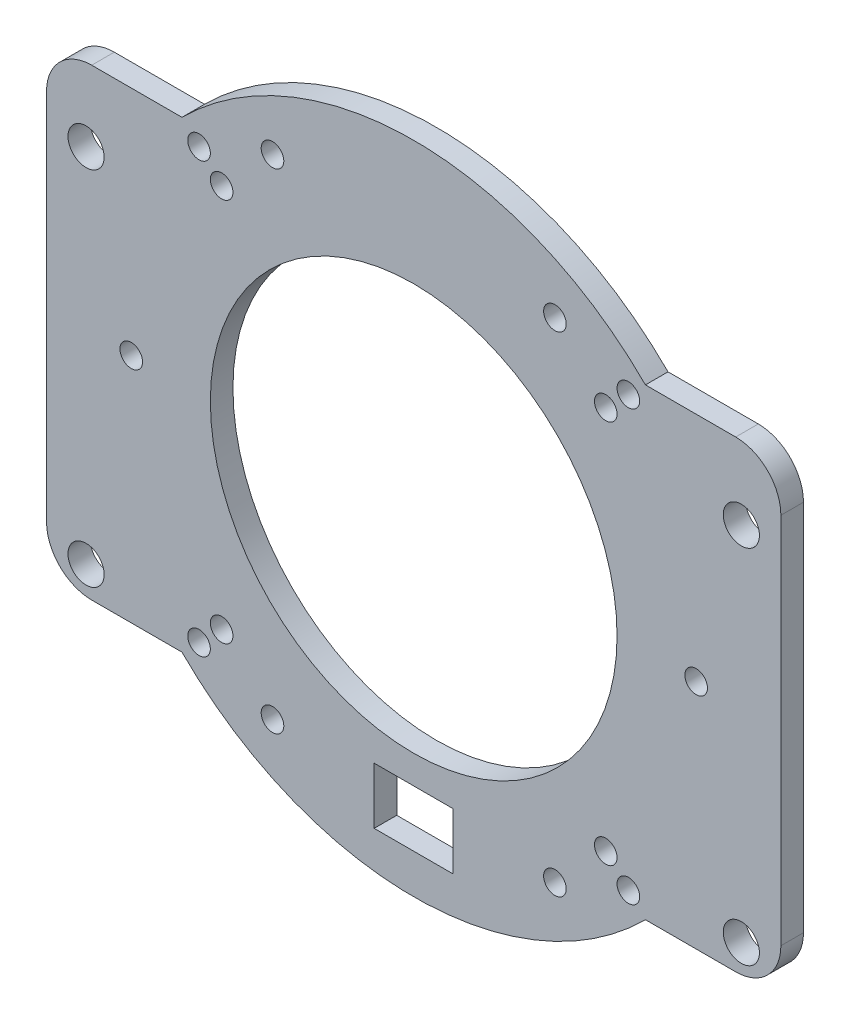
from build123d import *

# Parameters (mm, degrees)
SKETCH1_R             = 18
BOSS_EXTRUDE1_DEPTH   = 2
SKETCH2_R             = 1.6
CUT_EXTRUDE1_DEPTH    = 2
F_2_0MM_DOWEL_HOLE1_D = 2
FILLET1_R             = 4
SKETCH_1_W            = 7
SKETCH_1_H            = 5
CUT_EXTRUDE_1_DEPTH   = 44.603325561
F_2_0MM_1_D           = 2


with BuildPart() as part:
    # Sketch1 → Boss-Extrude1 (new body)
    with BuildSketch(Plane.XY):
        with BuildLine():
            Line((-32.5, 20.5), (-20.512191497, 20.5))
            ThreePointArc((-20.512191497, 20.5), (0, 29), (20.512191497, 20.5))
            Line((20.512191497, 20.5), (32.5, 20.5))
            Line((32.5, 20.5), (32.5, -20.5))
            Line((32.5, -20.5), (20.512191497, -20.5))
            ThreePointArc((20.512191497, -20.5), (0, -29), (-20.512191497, -20.5))
            Line((-20.512191497, -20.5), (-32.5, -20.5))
            Line((-32.5, -20.5), (-32.5, 20.5))
        make_face()
        Circle(SKETCH1_R, mode=Mode.SUBTRACT)
    extrude(amount=BOSS_EXTRUDE1_DEPTH)

    # Sketch2 → Cut-Extrude1 (cut)
    with BuildSketch(Plane.XY.offset(2)):
        with Locations((-29, 14)):
            Circle(SKETCH2_R)
        with Locations((-29, -18)):
            Circle(SKETCH2_R)
        with Locations((29, -18)):
            Circle(SKETCH2_R)
        with Locations((29, 14)):
            Circle(SKETCH2_R)
    extrude(amount=-CUT_EXTRUDE1_DEPTH, mode=Mode.SUBTRACT)

    # Ø2.0mm Dowel Hole1 (through all)
    with Locations(Plane(origin=(-19, 19, 2), x_dir=(1, 0, 0), z_dir=(0, 0, 1))):
        with Locations((0, 0), (2, -2), (36, -2), (38, 0), (36, -36), (38, -38), (0, -38), (2, -36)):
            Hole(F_2_0MM_DOWEL_HOLE1_D / 2)

    # Fillet1
    fillet1_edges = [part.edges().sort_by_distance(p)[0] for p in [
        (-32.5, -20.5, 1),
        (-32.5, 20.5, 1),
        (32.5, 20.5, 1),
        (32.5, -20.5, 1),
    ]]
    fillet(fillet1_edges, radius=FILLET1_R)

    # 스케치1 → 컷-돌출1 (cut, through all)
    with BuildSketch(Plane(origin=(0, 0, 0), x_dir=(-1, 0, 0), z_dir=(0, 0, -1))):
        with Locations((0, -23)):
            Rectangle(SKETCH_1_W, SKETCH_1_H)
    extrude(amount=-CUT_EXTRUDE_1_DEPTH, mode=Mode.SUBTRACT)

    # Ø2.0mm 맞춤핀 구멍1 (through all)
    with Locations(Plane(origin=(12.5, 21.650635095, 0), x_dir=(-1, 0, 0), z_dir=(0, 0, -1))):
        with Locations((0, 0), (25, 0), (37.5, -21.650635095), (25, -43.30127019), (0, -43.30127019), (-12.5, -21.650635095)):
            Hole(F_2_0MM_1_D / 2)


solid = part.part
